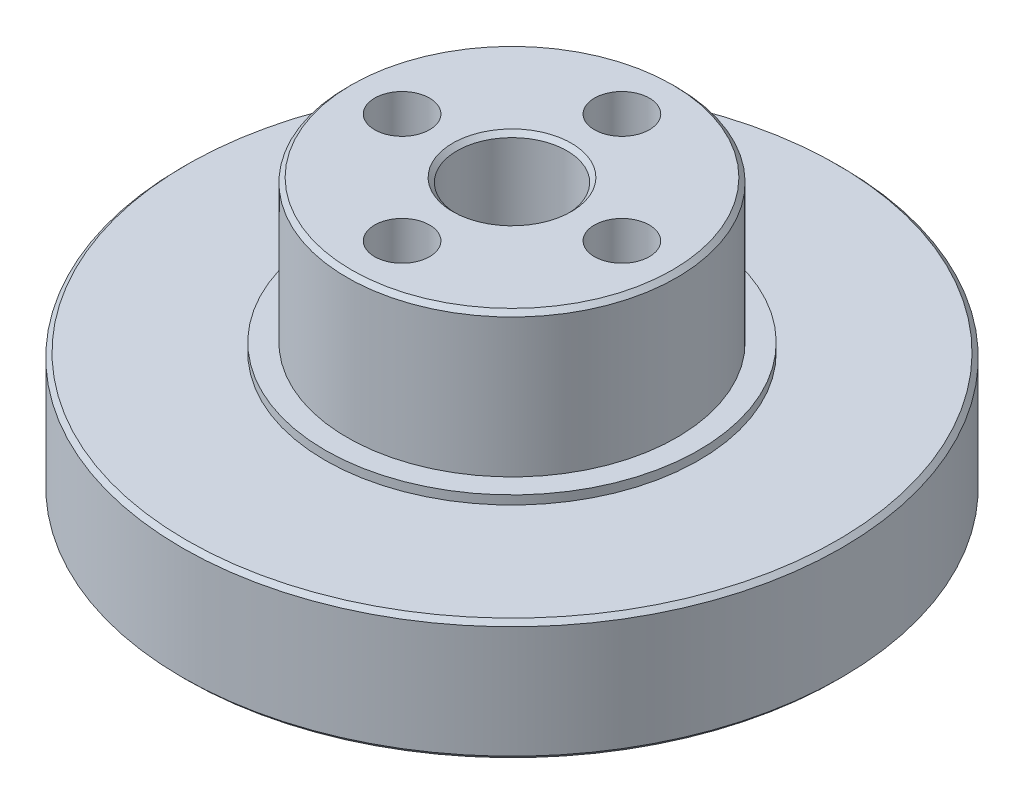
from build123d import *

# Parameters (mm, degrees)
SKETCH_1_R          = 15
SKETCH_1_R_2        = 2.075
EXTRUDE_1_DEPTH     = 4
SKETCH_2_R          = 15
EXTRUDE_2_DEPTH     = 1.5
SKETCH_3_R          = 8.5
EXTRUDE_3_DEPTH     = 0.4
SKETCH_4_R          = 7.5
EXTRUDE_4_DEPTH     = 6.5
SKETCH_5_R          = 1.25
SKETCH_5_R_2        = 2.5
CUT_EXTRUDE_1_DEPTH = 5
CHAMFER_1_SIZE      = 0.2
SKETCH_7_R          = 2.5
CUT_EXTRUDE_4_DEPTH = 23.46686449
SKETCH_8_R          = 6
CUT_EXTRUDE_5_DEPTH = 2
CHAMFER_2_SIZE      = 0.5


with BuildPart() as part:
    # 草图1 → 凸台-拉伸1 (new body)
    with BuildSketch(Plane(origin=(0, 0, 0), x_dir=(1, 0, 0), z_dir=(0, 1, 0))):
        with Locations(Location((0, 0, 0), (0, 0, 270))):
            Circle(SKETCH_1_R)
        with Locations(Location((0, 11.525, 0), (0, 0, 270))):
            Circle(SKETCH_1_R_2, mode=Mode.SUBTRACT)
        with Locations(Location((9.980942779, 5.7625, 0), (0, 0, 270))):
            Circle(SKETCH_1_R_2, mode=Mode.SUBTRACT)
        with Locations(Location((9.980942779, -5.7625, 0), (0, 0, 270))):
            Circle(SKETCH_1_R_2, mode=Mode.SUBTRACT)
        with Locations(Location((0, -11.525, 0), (0, 0, 270))):
            Circle(SKETCH_1_R_2, mode=Mode.SUBTRACT)
        with Locations(Location((-9.980942779, -5.7625, 0), (0, 0, 270))):
            Circle(SKETCH_1_R_2, mode=Mode.SUBTRACT)
        with Locations(Location((-9.980942779, 5.7625, 0), (0, 0, 270))):
            Circle(SKETCH_1_R_2, mode=Mode.SUBTRACT)
    extrude(amount=EXTRUDE_1_DEPTH)

    # 草图2 → 凸台-拉伸2 (add)
    with BuildSketch(Plane(origin=(0, 4, 0), x_dir=(1, 0, 0), z_dir=(0, 1, 0))):
        with Locations(Location((0, 0, 0), (0, 0, 270))):
            Circle(SKETCH_2_R)
    extrude(amount=EXTRUDE_2_DEPTH)

    # 草图3 → 凸台-拉伸3 (add)
    with BuildSketch(Plane(origin=(0, 5.5, 0), x_dir=(1, 0, 0), z_dir=(0, 1, 0))):
        with Locations(Location((0, 0, 0), (0, 0, 270))):
            Circle(SKETCH_3_R)
    extrude(amount=EXTRUDE_3_DEPTH)

    # 草图4 → 凸台-拉伸4 (add)
    with BuildSketch(Plane(origin=(0, 5.9, 0), x_dir=(1, 0, 0), z_dir=(0, 1, 0))):
        with Locations(Location((0, 0, 0), (0, 0, 90))):
            Circle(SKETCH_4_R)
    extrude(amount=EXTRUDE_4_DEPTH)

    # 草图5 → 切除-拉伸1 (cut)
    with BuildSketch(Plane(origin=(0, 12.4, 0), x_dir=(1, 0, 0), z_dir=(0, 1, 0))):
        with Locations(Location((0, 5, 0), (0, 0, 270))):
            Circle(SKETCH_5_R)
        with Locations(Location((5, 0, 0), (0, 0, 270))):
            Circle(SKETCH_5_R)
        with Locations(Location((0, -5, 0), (0, 0, 270))):
            Circle(SKETCH_5_R)
        with Locations(Location((-5, 0, 0), (0, 0, 270))):
            Circle(SKETCH_5_R)
        with Locations(Location((0, 0, 0), (0, 0, 270))):
            Circle(SKETCH_5_R_2)
    extrude(amount=-CUT_EXTRUDE_1_DEPTH, mode=Mode.SUBTRACT)

    # 倒角1
    chamfer_1_edges = [part.edges().sort_by_distance(p)[0] for p in [
        (9.980942779, 0, 3.6875),
        (0, 0, 9.45),
        (0, 0, -15),
        (-9.980942779, 0, 3.6875),
        (-9.980942779, 0, -7.8375),
        (0, 5.5, -15),
        (0, 12.4, 7.5),
        (0, 0, -13.6),
        (0, 12.4, -2.5),
        (9.980942779, 0, -7.8375),
    ]]
    chamfer(chamfer_1_edges, length=CHAMFER_1_SIZE)

    # 草图7 → 切除-拉伸4 (cut, through all)
    with BuildSketch(Plane(origin=(0, 7.4, 0), x_dir=(1, 0, 0), z_dir=(0, 1, 0))):
        with Locations(Location((0, 0, 0), (0, 0, 270))):
            Circle(SKETCH_7_R)
    extrude(amount=-CUT_EXTRUDE_4_DEPTH, mode=Mode.SUBTRACT)

    # 草图8 → 切除-拉伸5 (cut)
    with BuildSketch(Plane(origin=(0, 0, 0), x_dir=(-1, 0, 0), z_dir=(0, -1, 0))):
        with Locations(Location((0, 0, 0), (0, 0, 90))):
            Circle(SKETCH_8_R)
    extrude(amount=-CUT_EXTRUDE_5_DEPTH, mode=Mode.SUBTRACT)

    # 倒角2
    chamfer_2_edges = [part.edges().sort_by_distance(p)[0] for p in [
        (0, 0, 6),
        (0, 2, 6),
        (0, 2, -2.5),
    ]]
    chamfer(chamfer_2_edges, length=CHAMFER_2_SIZE)


solid = part.part
